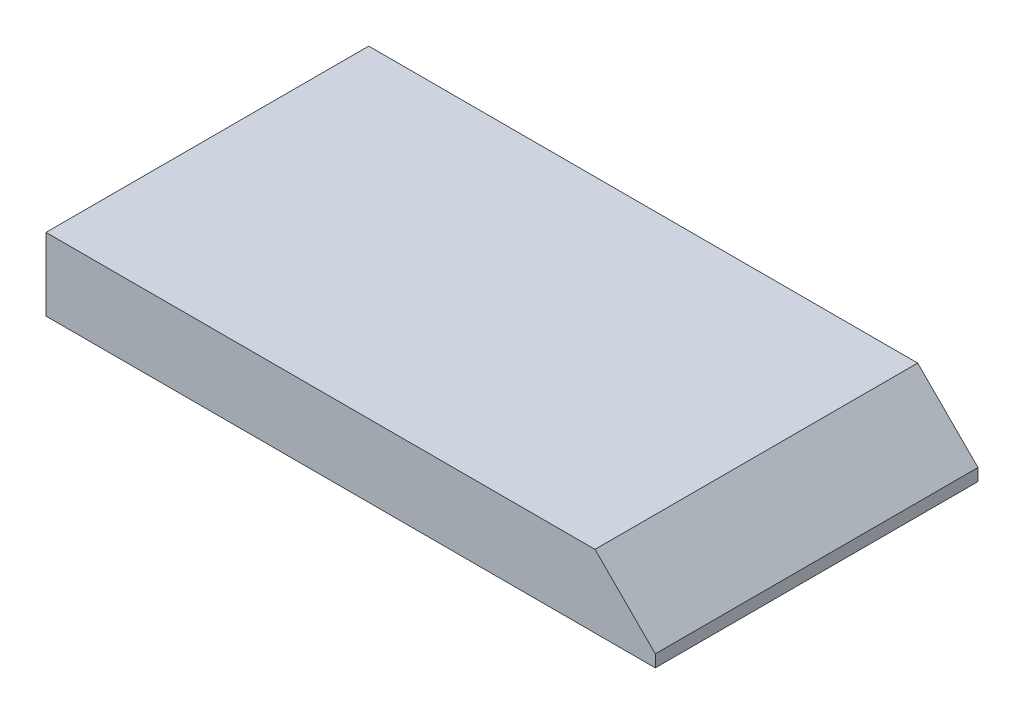
from build123d import *

# Parameters (mm, degrees)
BOSS_EXTRUDE1_DEPTH = 52.96


with BuildPart() as part:
    # Sketch1 → Boss-Extrude1 (new body)
    with BuildSketch(Plane.XY):
        Polygon((100, -9.899494937), (90.100505063, 0), (0, 0), (0, -11.899494937), (100, -11.899494937), align=None)
    extrude(amount=BOSS_EXTRUDE1_DEPTH)


solid = part.part
